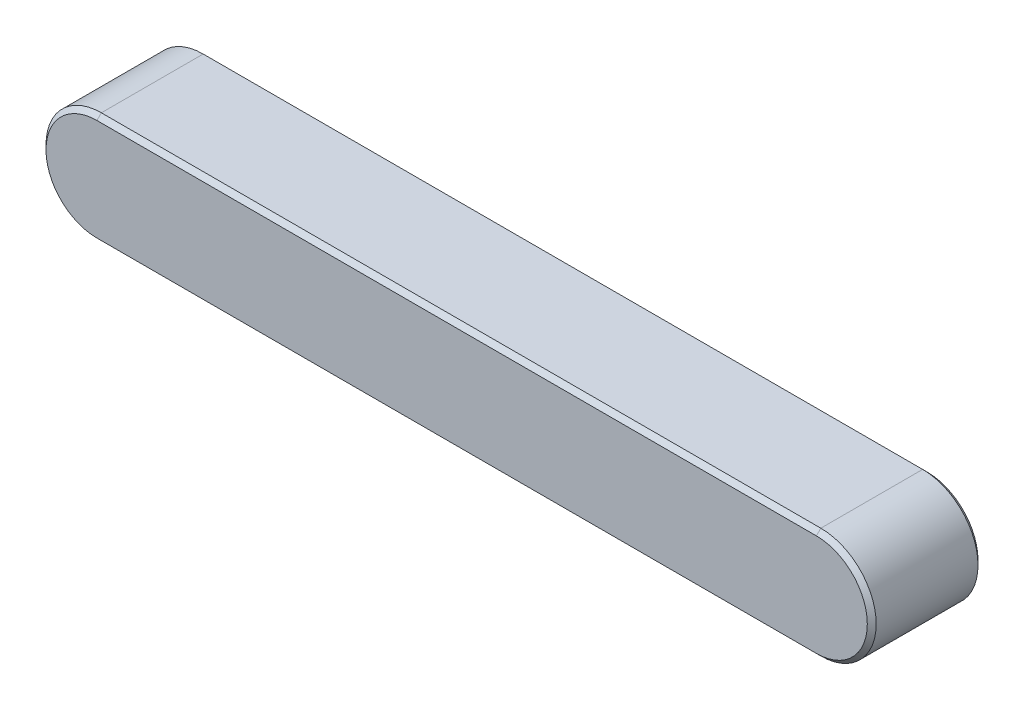
from build123d import *

# Parameters (mm, degrees)
EXTRUDE_1_DEPTH = 4
CHAMFER_1_SIZE  = 0.16


with BuildPart() as part:
    # 草图1 → 凸台-拉伸1 (new body)
    with BuildSketch(Plane.XY):
        with BuildLine():
            Line((-13, 2), (13, 2))
            ThreePointArc((13, 2), (15, 0), (13, -2))
            Line((13, -2), (-13, -2))
            ThreePointArc((-13, -2), (-15, 0), (-13, 2))
        make_face()
    extrude(amount=EXTRUDE_1_DEPTH)

    # 倒角1
    chamfer_1_edges = [part.edges().sort_by_distance(p)[0] for p in [
        (15, 0, 4),
        (0, 2, 4),
        (-15, 0, 4),
        (0, 2, 0),
        (15, 0, 0),
        (0, -2, 0),
        (-15, 0, 0),
        (0, -2, 4),
    ]]
    chamfer(chamfer_1_edges, length=CHAMFER_1_SIZE)


solid = part.part
